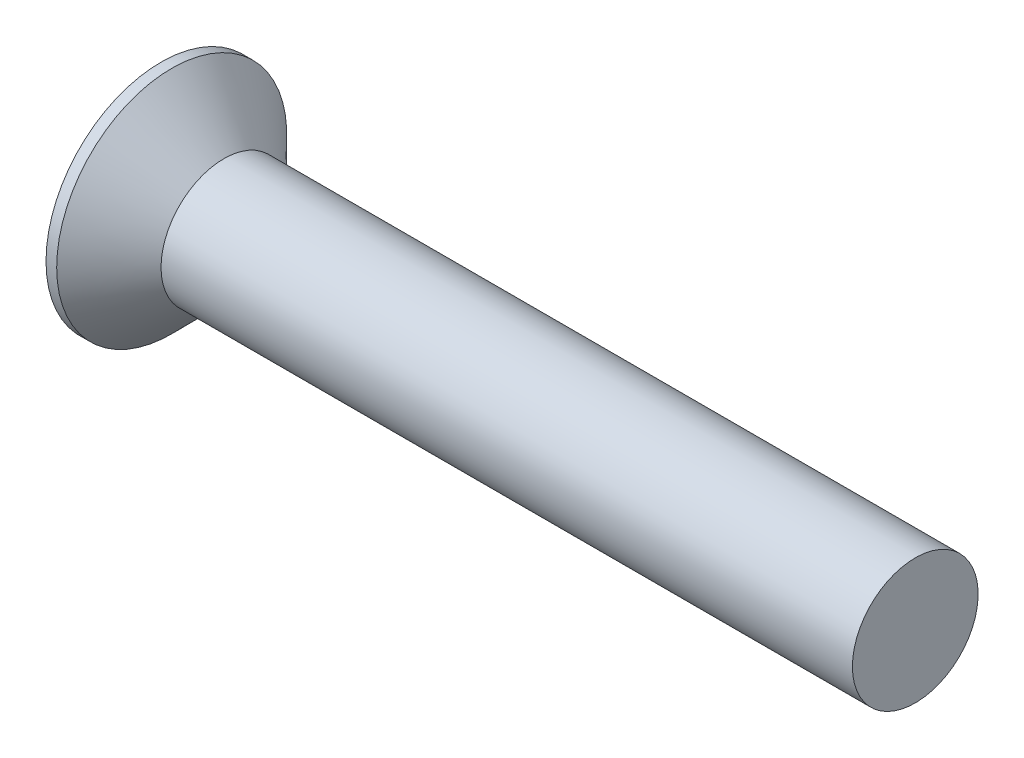
from build123d import *

# Parameters (mm, degrees)
CIRPATTERN1_COUNT = 2
CIRPATTERN1_ANGLE = 90


with BuildPart() as part:
    # BodySke → Base-Revolve (revolve)
    with BuildSketch(Plane.XY, mode=Mode.PRIVATE) as base_revolve_sk:
        Polygon((0, 0), (0, 9.15), (0.85, 9.15), (5, 5), (60, 5), (60, 0), align=None)
    revolve(base_revolve_sk.sketch.rotate(Axis((-6.35, 0, 0), (1, 0, 0)), 90), axis=Axis((-6.35, 0, 0), (1, 0, 0)))

    # Sketch3 → Cross section 0
    with BuildSketch(Plane.ZY):
        with BuildLine():
            Line((-0.99, 4.94), (0.99, 4.94))
            Line((0.99, 4.94), (0.99, -4.94))
            Line((0.99, -4.94), (-0.99, -4.94))
            Line((-0.99, -4.94), (-0.99, 4.94))
        make_face()
    # Sketch4 → Cross section 1
    with BuildSketch(Plane.ZY.offset(-5.98)):
        with BuildLine():
            Line((-0.495, 0.495), (0.495, 0.495))
            Line((0.495, 0.495), (0.495, -0.495))
            Line((0.495, -0.495), (-0.495, -0.495))
            Line((-0.495, -0.495), (-0.495, 0.495))
        make_face()
    cross = loft(mode=Mode.SUBTRACT)

    # CirPattern1: Cross ×2 about axis
    cirpattern1_axis = Axis((0, 0, 0), (1, 0, 0))
    for i in range(1, CIRPATTERN1_COUNT):
        add(cross.rotate(cirpattern1_axis, i * CIRPATTERN1_ANGLE / (CIRPATTERN1_COUNT - 1)), mode=Mode.SUBTRACT)


solid = part.part
